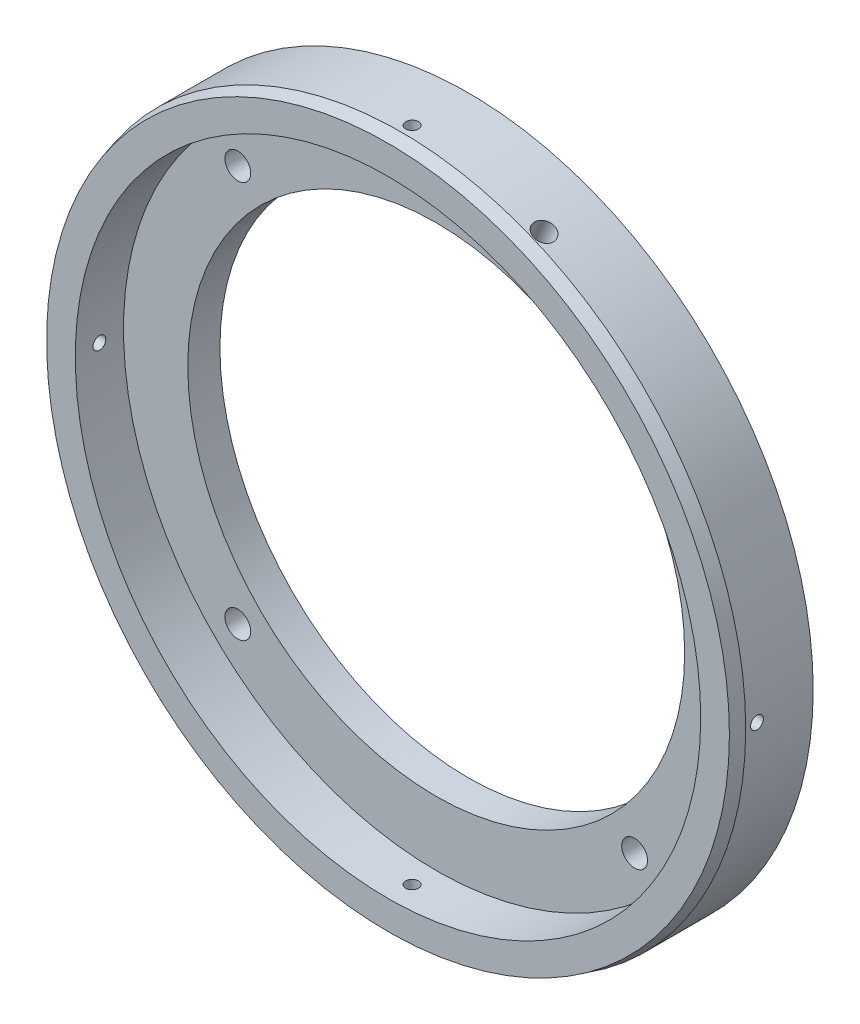
from build123d import *

# Parameters (mm, degrees)
SKETCH1_R                       = 68.1355
SKETCH1_R_2                     = 49.0855
EXTRUDE1_DEPTH                  = 15.875
SKETCH2_R                       = 61.7855
EXTRUDE2_DEPTH                  = 9.525
F_21_0_159_DIAMETER_HOLE1_D     = 4.0386
F_21_0_159_DIAMETER_HOLE1_DEPTH = 12.7
F_21_0_159_DIAMETER_HOLE1_TIP   = 1.213317848
CIRPATTERN1_COUNT               = 4
CIRPATTERN2_COUNT               = 4
CHAMFER1_SIZE                   = 2.54
CHAMFER1_SIZE2                  = 0.680590949


with BuildPart() as part:
    # Sketch1 → Extrude1 (new body)
    with BuildSketch(Plane.XY):
        Circle(SKETCH1_R)
        Circle(SKETCH1_R_2, mode=Mode.SUBTRACT)
    extrude(amount=EXTRUDE1_DEPTH)

    # Sketch2 → Extrude2 (cut)
    with BuildSketch(Plane.XY.offset(15.875)):
        Circle(SKETCH2_R)
    extrude(amount=-EXTRUDE2_DEPTH, mode=Mode.SUBTRACT)

    # #21 (0.159) Diameter Hole1
    with Locations(Plane(origin=(26.074327006, 62.948993887, 11.1125), x_dir=(-0.9238795325112864, 0.38268343236509067, 0), z_dir=(0.38268343236509067, 0.9238795325112864, 0))):
        with Locations((0, 0)):
            Hole(F_21_0_159_DIAMETER_HOLE1_D / 2, depth=F_21_0_159_DIAMETER_HOLE1_DEPTH)
            with Locations((0, 0, -(F_21_0_159_DIAMETER_HOLE1_DEPTH + F_21_0_159_DIAMETER_HOLE1_TIP / 2))):  # 118° drill point
                Cone(0, F_21_0_159_DIAMETER_HOLE1_D / 2, F_21_0_159_DIAMETER_HOLE1_TIP, mode=Mode.SUBTRACT)

    # Sketch4 → #39 (0.0995) Diameter Hole2 (revolve, cut)
    with BuildSketch(Plane(origin=(0, 68.1355, 11.1125), x_dir=(0, 0, 1), z_dir=(1, 0, 0))):
        Polygon((0, 0), (0, 13.459277521), (1.26365, 12.7), (1.26365, 0), align=None)
    f_39_0_0995_diameter_hole2 = revolve(axis=Axis((0, 74.4855, 11.1125), (0, -1, 0)), mode=Mode.SUBTRACT)

    # CirPattern1: #39 (0.0995) Diameter Hole2 ×4 about axis
    cirpattern1_axis = Axis((0, 0, 15.875), (0, 0, -1))
    for i in range(1, CIRPATTERN1_COUNT):
        add(f_39_0_0995_diameter_hole2.rotate(cirpattern1_axis, i * 360 / CIRPATTERN1_COUNT), mode=Mode.SUBTRACT)

    # Sketch8 → #7 (0.201) Diameter Hole1 (revolve, cut)
    with BuildSketch(Plane(origin=(39.198817968, 39.198817968, 11.1125), x_dir=(0, -1, 0), z_dir=(1, 0, 0))):
        Polygon((0, 0), (0, 14.233816902), (2.5527, 12.7), (2.5527, 0), align=None)
    f_7_0_201_diameter_hole1 = revolve(axis=Axis((39.198817968, 39.198817968, 17.4625), (0, 0, -1)), mode=Mode.SUBTRACT)

    # CirPattern2: #7 (0.201) Diameter Hole1 ×4 about axis
    cirpattern2_axis = Axis((0, 0, 0), (0, 0, 1))
    for i in range(1, CIRPATTERN2_COUNT):
        add(f_7_0_201_diameter_hole1.rotate(cirpattern2_axis, i * 360 / CIRPATTERN2_COUNT), mode=Mode.SUBTRACT)

    # Chamfer1
    chamfer1_edges = [part.edges().sort_by_distance(p)[0] for p in [
        (-68.1355, 0, 15.875),
    ]]
    chamfer1_side = [part.faces().sort_by_distance(p)[0] for p in [
        (-68.1355, 0, 7.9375),
    ]]
    chamfer(chamfer1_edges, length=CHAMFER1_SIZE, length2=CHAMFER1_SIZE2, reference=chamfer1_side[0])


solid = part.part
